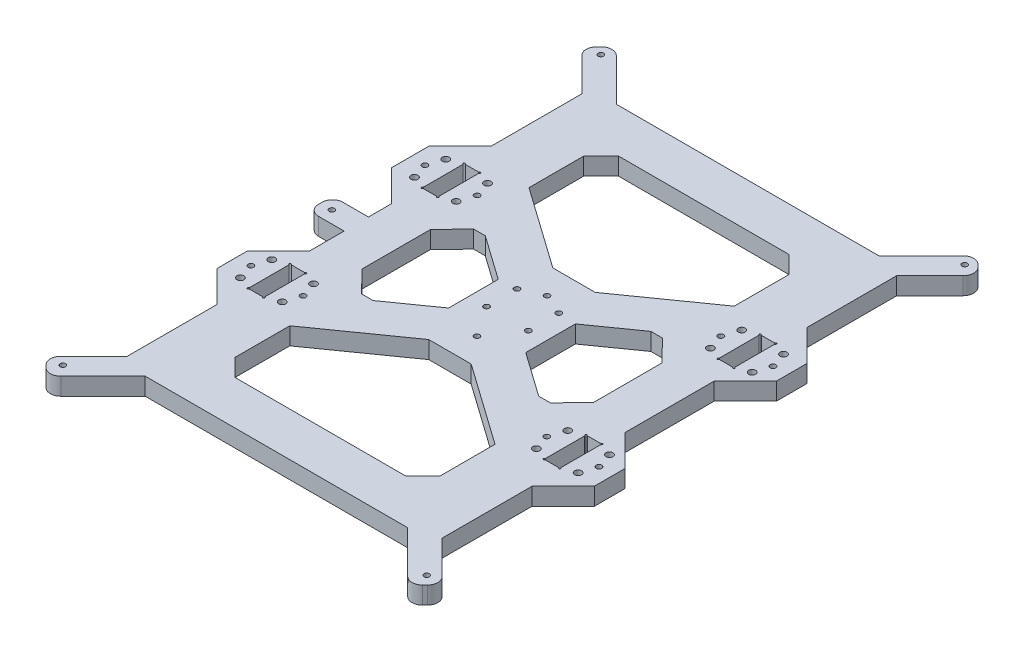
from build123d import *

# Parameters (mm, degrees)
CROQUIS1_R              = 1.6
CROQUIS1_R_2            = 1.55
CROQUIS1_R_3            = 2
SALIENTE_EXTRUIR1_DEPTH = 10


with BuildPart() as part:
    # Croquis1 → Saliente-Extruir1 (new body)
    with BuildSketch(Plane(origin=(0, 0, 0), x_dir=(1, 0, 0), z_dir=(0, 1, 0))):
        with BuildLine():
            Line((-80.748622992, 159.562049364), (-82.162836554, 158.147835801))
            ThreePointArc((-82.162836554, 158.147835801), (-83.920195867, 153.905195114), (-82.162836554, 149.662554427))
            Line((-82.162836554, 149.662554427), (-63.049396634, 130.549114507))
            Line((-63.049396634, 130.549114507), (-63.049396634, 78.874114811))
            Line((-63.049396634, 78.874114811), (-72.931544444, 68.991967001))
            Line((-72.931544444, 68.991967001), (-80.934057958, 60.989453487))
            Line((-80.934057958, 60.989453487), (-80.934057958, 58.991967001))
            Line((-80.934057958, 58.991967001), (-80.934057958, 39.010546513))
            Line((-80.934057958, 39.010546513), (-72.931544444, 31.008032999))
            Line((-72.931544444, 31.008032999), (-63.049396634, 21.125885189))
            Line((-63.049396634, 21.125885189), (-63.049396634, 7.998522997))
            Line((-63.049396634, 7.998522997), (-77.731651282, 7.998522997))
            ThreePointArc((-77.731651282, 7.998522997), (-81.974291969, 6.241163685), (-83.731651282, 1.998522997))
            Line((-83.731651282, 1.998522997), (-83.731651282, -0.001477003))
            ThreePointArc((-83.731651282, -0.001477003), (-81.974291969, -4.24411769), (-77.731651282, -6.001477003))
            Line((-77.731651282, -6.001477003), (-63.049396634, -6.001477003))
            Line((-63.049396634, -6.001477003), (-63.049396634, -25.681678258))
            Line((-63.049396634, -25.681678258), (-72.931544444, -35.563826068))
            Line((-72.931544444, -35.563826068), (-80.934057958, -43.566339582))
            Line((-80.934057958, -43.566339582), (-80.934057958, -60.989453487))
            Line((-80.934057958, -60.989453487), (-72.931544444, -68.991967001))
            Line((-72.931544444, -68.991967001), (-63.049396634, -78.874114811))
            Line((-63.049396634, -78.874114811), (-63.049396634, -130.549114507))
            Line((-63.049396634, -130.549114507), (-82.14179751, -149.641515383))
            ThreePointArc((-82.14179751, -149.641515383), (-83.899156822, -153.88415607), (-82.14179751, -158.126796757))
            Line((-82.14179751, -158.126796757), (-80.727583947, -159.541010319))
            ThreePointArc((-80.727583947, -159.541010319), (-76.48494326, -161.298369632), (-72.242302573, -159.541010319))
            Line((-72.242302573, -159.541010319), (-47.994082864, -135.29279061))
            Line((-47.994082864, -135.29279061), (102.792508483, -135.29279061))
            Line((102.792508483, -135.29279061), (127.051296229, -159.551578356))
            ThreePointArc((127.051296229, -159.551578356), (131.293936917, -161.308937669), (135.536577604, -159.551578356))
            Line((135.536577604, -159.551578356), (136.950791166, -158.137364794))
            ThreePointArc((136.950791166, -158.137364794), (138.708150479, -153.894724107), (136.950791166, -149.65208342))
            Line((136.950791166, -149.65208342), (117.847822253, -130.549114507))
            Line((117.847822253, -130.549114507), (117.847822253, -78.874114811))
            Line((117.847822253, -78.874114811), (127.729970063, -68.991967001))
            Line((127.729970063, -68.991967001), (135.734403375, -60.987533689))
            Line((135.734403375, -60.987533689), (135.734403375, -43.56825938))
            Line((135.734403375, -43.56825938), (127.729970063, -35.563826068))
            Line((127.729970063, -35.563826068), (117.847822253, -25.681678258))
            Line((117.847822253, -25.681678258), (117.847822253, 25.681678258))
            Line((117.847822253, 25.681678258), (127.729970063, 35.563826068))
            Line((127.729970063, 35.563826068), (135.734403375, 43.56825938))
            Line((135.734403375, 43.56825938), (135.734403375, 58.991967001))
            Line((135.734403375, 58.991967001), (135.734403375, 60.987533689))
            Line((135.734403375, 60.987533689), (127.729970063, 68.991967001))
            Line((127.729970063, 68.991967001), (117.847822253, 78.874114811))
            Line((117.847822253, 78.874114811), (117.847822253, 130.549114507))
            Line((117.847822253, 130.549114507), (136.942441846, 149.643734099))
            ThreePointArc((136.942441846, 149.643734099), (138.699801158, 153.886374787), (136.942441846, 158.129015474))
            Line((136.942441846, 158.129015474), (135.528228283, 159.543229036))
            ThreePointArc((135.528228283, 159.543229036), (131.285587596, 161.300588349), (127.042946909, 159.543229036))
            Line((127.042946909, 159.543229036), (102.792508483, 135.29279061))
            Line((102.792508483, 135.29279061), (-47.994082864, 135.29279061))
            Line((-47.994082864, 135.29279061), (-72.263341617, 159.562049364))
            ThreePointArc((-72.263341617, 159.562049364), (-76.505982304, 161.319408677), (-80.748622992, 159.562049364))
        make_face()
        with Locations(Location((-72.60085541, -50.001190143, 0), (0, 0, 270))):
            Circle(CROQUIS1_R, mode=Mode.SUBTRACT)
        with Locations(Location((-72.60085541, 49.957044921, 0), (0, 0, 270))):
            Circle(CROQUIS1_R, mode=Mode.SUBTRACT)
        with Locations(Location((97.39914459, -50.001195503, 0), (0, 0, 270))):
            Circle(CROQUIS1_R, mode=Mode.SUBTRACT)
        with Locations(Location((-77.10078719, 155.498522997, 0), (0, 0, 270))):
            Circle(CROQUIS1_R_2, mode=Mode.SUBTRACT)
        with Locations(Location((131.89921281, 155.498522997, 0), (0, 0, 90))):
            Circle(CROQUIS1_R_2, mode=Mode.SUBTRACT)
        with Locations(Location((97.39914459, 49.957044921, 0), (0, 0, 270))):
            Circle(CROQUIS1_R, mode=Mode.SUBTRACT)
        with Locations(Location((27.39921281, 20.131279802, 0), (0, 0, 270))):
            Circle(CROQUIS1_R_2, mode=Mode.SUBTRACT)
        with Locations(Location((27.39921281, -20.131279802, 0), (0, 0, 90))):
            Circle(CROQUIS1_R_2, mode=Mode.SUBTRACT)
        with Locations(Location((-77.10078719, 0.998522997, 0), (0, 0, 270))):
            Circle(CROQUIS1_R_2, mode=Mode.SUBTRACT)
        with Locations(Location((131.89921281, -153.501477003, 0), (0, 0, 270))):
            Circle(CROQUIS1_R_2, mode=Mode.SUBTRACT)
        with Locations(Location((-77.10078719, -153.501477003, 0), (0, 0, 90))):
            Circle(CROQUIS1_R_2, mode=Mode.SUBTRACT)
        with Locations(Location((100.399202808, 58.95703559, 0), (0, 0, 270))):
            Circle(CROQUIS1_R_3, mode=Mode.SUBTRACT)
        with Locations(Location((124.399202808, 58.95703559, 0), (0, 0, 270))):
            Circle(CROQUIS1_R_3, mode=Mode.SUBTRACT)
        with Locations(Location((124.399202808, 40.95703559, 0), (0, 0, 270))):
            Circle(CROQUIS1_R_3, mode=Mode.SUBTRACT)
        with Locations(Location((100.399202808, 40.95703559, 0), (0, 0, 270))):
            Circle(CROQUIS1_R_3, mode=Mode.SUBTRACT)
        with Locations(Location((100.399202808, -41.001204721, 0), (0, 0, 270))):
            Circle(CROQUIS1_R_3, mode=Mode.SUBTRACT)
        with Locations(Location((124.399202808, -41.001204721, 0), (0, 0, 270))):
            Circle(CROQUIS1_R_3, mode=Mode.SUBTRACT)
        with Locations(Location((124.399202808, -59.001204721, 0), (0, 0, 270))):
            Circle(CROQUIS1_R_3, mode=Mode.SUBTRACT)
        with Locations(Location((100.399202808, -59.001204721, 0), (0, 0, 270))):
            Circle(CROQUIS1_R_3, mode=Mode.SUBTRACT)
        with Locations(Location((-69.60078719, 58.957035704, 0), (0, 0, 270))):
            Circle(CROQUIS1_R_3, mode=Mode.SUBTRACT)
        with Locations(Location((-45.60078719, 58.957035704, 0), (0, 0, 270))):
            Circle(CROQUIS1_R_3, mode=Mode.SUBTRACT)
        with Locations(Location((-45.60078719, 40.957035704, 0), (0, 0, 270))):
            Circle(CROQUIS1_R_3, mode=Mode.SUBTRACT)
        with Locations(Location((-69.60078719, 40.957035704, 0), (0, 0, 270))):
            Circle(CROQUIS1_R_3, mode=Mode.SUBTRACT)
        with Locations(Location((-69.600797192, -41.001199264, 0), (0, 0, 270))):
            Circle(CROQUIS1_R_3, mode=Mode.SUBTRACT)
        with Locations(Location((-45.600797192, -41.001199264, 0), (0, 0, 270))):
            Circle(CROQUIS1_R_3, mode=Mode.SUBTRACT)
        with Locations(Location((-45.600797192, -59.001199264, 0), (0, 0, 270))):
            Circle(CROQUIS1_R_3, mode=Mode.SUBTRACT)
        with Locations(Location((-69.600797192, -59.001199264, 0), (0, 0, 270))):
            Circle(CROQUIS1_R_3, mode=Mode.SUBTRACT)
        with Locations(Location((39.39921281, 14.868720198, 0), (0, 0, 270))):
            Circle(CROQUIS1_R, mode=Mode.SUBTRACT)
        with Locations(Location((15.39921281, 14.868720198, 0), (0, 0, 270))):
            Circle(CROQUIS1_R, mode=Mode.SUBTRACT)
        with Locations(Location((39.39921281, -2.631279802, 0), (0, 0, 270))):
            Circle(CROQUIS1_R, mode=Mode.SUBTRACT)
        with Locations(Location((15.39921281, -2.631279802, 0), (0, 0, 270))):
            Circle(CROQUIS1_R, mode=Mode.SUBTRACT)
        with Locations(Location((-42.60085541, 49.957020155, 0), (0, 0, 270))):
            Circle(CROQUIS1_R, mode=Mode.SUBTRACT)
        with Locations(Location((-42.60085541, -50.001214909, 0), (0, 0, 270))):
            Circle(CROQUIS1_R, mode=Mode.SUBTRACT)
        with Locations(Location((127.39914459, 49.957020155, 0), (0, 0, 270))):
            Circle(CROQUIS1_R, mode=Mode.SUBTRACT)
        with Locations(Location((127.39914459, -50.001220269, 0), (0, 0, 270))):
            Circle(CROQUIS1_R, mode=Mode.SUBTRACT)
        Polygon((-39.036453098, 19.62934529), (-39.036453098, -19.62934529), (-26.843918916, -32.22180516), (-20.164597864, -32.22180516), (5.244035613, -14.252996646), (5.244035613, 14.252996646), (-20.164597864, 32.22180516), (-26.843918916, 32.22180516), align=None, mode=Mode.SUBTRACT)
        Polygon((-31.542972252, 100.139969228), (-31.542972252, 68.700211283), (15.217390497, 35.631608635), (39.581035122, 35.631608635), (86.341397871, 68.700211283), (86.341397871, 100.139969228), (76.341397871, 110.139969228), (-21.542972252, 110.139969228), align=None, mode=Mode.SUBTRACT)
        with BuildLine():
            Line((-61.23476769, -37.951196668), (-53.96680669, -37.951199668))
            ThreePointArc((-53.96680669, -37.951199668), (-53.716807383, -37.884213008), (-53.533794646, -37.701201522))
            ThreePointArc((-53.533794646, -37.701201522), (-52.747229229, -37.597651368), (-52.850783941, -38.384216185))
            ThreePointArc((-52.850783941, -38.384216185), (-53.033795864, -38.567227373), (-53.100784037, -38.81722546))
            Line((-53.100784037, -38.81722546), (-53.100802502, -61.18517446))
            ThreePointArc((-53.100802502, -61.18517446), (-53.033815411, -61.435174515), (-52.85080286, -61.618187368))
            ThreePointArc((-52.85080286, -61.618187368), (-52.747249037, -62.404753791), (-53.533815709, -62.301201857))
            ThreePointArc((-53.533815709, -62.301201857), (-53.71682792, -62.118190482), (-53.966826693, -62.051203569))
            Line((-53.966826693, -62.051203569), (-61.234787693, -62.051197537))
            ThreePointArc((-61.234787693, -62.051197537), (-61.484787748, -62.118184628), (-61.667800601, -62.301197179))
            ThreePointArc((-61.667800601, -62.301197179), (-62.454367024, -62.404751002), (-62.35081509, -61.61818433))
            ThreePointArc((-62.35081509, -61.61818433), (-62.167803248, -61.435171927), (-62.100816152, -61.185172721))
            Line((-62.100816152, -61.185172721), (-62.100797686, -38.817219721))
            ThreePointArc((-62.100797686, -38.817219721), (-62.167784346, -38.567220414), (-62.350795832, -38.384207677))
            ThreePointArc((-62.350795832, -38.384207677), (-62.454345986, -37.59764226), (-61.667781169, -37.701196972))
            ThreePointArc((-61.667781169, -37.701196972), (-61.484768059, -37.884209661), (-61.23476769, -37.951196668))
        make_face(mode=Mode.SUBTRACT)
        with BuildLine():
            Line((108.76523231, -37.951202028), (116.03319331, -37.951205028))
            ThreePointArc((116.03319331, -37.951205028), (116.283192617, -37.884218369), (116.466205354, -37.701206882))
            ThreePointArc((116.466205354, -37.701206882), (117.252770771, -37.597656728), (117.149216059, -38.384221545))
            ThreePointArc((117.149216059, -38.384221545), (116.966204136, -38.567232733), (116.899215963, -38.81723082))
            Line((116.899215963, -38.81723082), (116.899197498, -61.18517982))
            ThreePointArc((116.899197498, -61.18517982), (116.966184589, -61.435179876), (117.14919714, -61.618192729))
            ThreePointArc((117.14919714, -61.618192729), (117.252750963, -62.404759152), (116.466184291, -62.301207218))
            ThreePointArc((116.466184291, -62.301207218), (116.28317208, -62.118195842), (116.033173307, -62.051208929))
            Line((116.033173307, -62.051208929), (108.765212307, -62.051202897))
            ThreePointArc((108.765212307, -62.051202897), (108.515212252, -62.118189989), (108.332199399, -62.301202539))
            ThreePointArc((108.332199399, -62.301202539), (107.545632976, -62.404756362), (107.64918491, -61.61818969))
            ThreePointArc((107.64918491, -61.61818969), (107.832196752, -61.435177287), (107.899183848, -61.185178081))
            Line((107.899183848, -61.185178081), (107.899202314, -38.817225081))
            ThreePointArc((107.899202314, -38.817225081), (107.832215654, -38.567225774), (107.649204168, -38.384213037))
            ThreePointArc((107.649204168, -38.384213037), (107.545654014, -37.59764762), (108.332218831, -37.701202332))
            ThreePointArc((108.332218831, -37.701202332), (108.515231941, -37.884215022), (108.76523231, -37.951202028))
        make_face(mode=Mode.SUBTRACT)
        Polygon((74.963023483, 32.22180516), (49.554390006, 14.252996646), (49.554390006, -14.252996646), (74.963023483, -32.22180516), (81.642344535, -32.22180516), (93.834878717, -19.62934529), (93.834878717, 19.62934529), (81.642344535, 32.22180516), align=None, mode=Mode.SUBTRACT)
        with BuildLine():
            Line((108.76523231, 62.007038396), (116.03319331, 62.007035396))
            ThreePointArc((116.03319331, 62.007035396), (116.283192617, 62.074022056), (116.466205354, 62.257033542))
            ThreePointArc((116.466205354, 62.257033542), (117.252770771, 62.360583696), (117.149216059, 61.574018879))
            ThreePointArc((117.149216059, 61.574018879), (116.966204136, 61.391007691), (116.899215963, 61.141009604))
            Line((116.899215963, 61.141009604), (116.899197498, 38.773060604))
            ThreePointArc((116.899197498, 38.773060604), (116.966184589, 38.523060549), (117.14919714, 38.340047696))
            ThreePointArc((117.14919714, 38.340047696), (117.252750963, 37.553481273), (116.466184291, 37.657033207))
            ThreePointArc((116.466184291, 37.657033207), (116.28317208, 37.840044582), (116.033173307, 37.907031495))
            Line((116.033173307, 37.907031495), (108.765212307, 37.907037528))
            ThreePointArc((108.765212307, 37.907037528), (108.515212252, 37.840050436), (108.332199399, 37.657037885))
            ThreePointArc((108.332199399, 37.657037885), (107.545632976, 37.553484062), (107.64918491, 38.340050734))
            ThreePointArc((107.64918491, 38.340050734), (107.832196752, 38.523063137), (107.899183848, 38.773062343))
            Line((107.899183848, 38.773062343), (107.899202314, 61.141015343))
            ThreePointArc((107.899202314, 61.141015343), (107.832215654, 61.39101465), (107.649204168, 61.574027387))
            ThreePointArc((107.649204168, 61.574027387), (107.545654014, 62.360592804), (108.332218831, 62.257038092))
            ThreePointArc((108.332218831, 62.257038092), (108.515231941, 62.074025403), (108.76523231, 62.007038396))
        make_face(mode=Mode.SUBTRACT)
        Polygon((-21.542972252, -110.139969228), (76.341397871, -110.139969228), (86.341397871, -100.139969228), (86.341397871, -68.700211283), (39.581035122, -35.631608635), (15.217390497, -35.631608635), (-31.542972252, -68.700211283), (-31.542972252, -100.139969228), align=None, mode=Mode.SUBTRACT)
        with BuildLine():
            Line((-61.23476769, 62.007038396), (-53.96680669, 62.007035396))
            ThreePointArc((-53.96680669, 62.007035396), (-53.716807383, 62.074022056), (-53.533794646, 62.257033542))
            ThreePointArc((-53.533794646, 62.257033542), (-52.747229229, 62.360583696), (-52.850783941, 61.574018879))
            ThreePointArc((-52.850783941, 61.574018879), (-53.033795864, 61.391007691), (-53.100784037, 61.141009604))
            Line((-53.100784037, 61.141009604), (-53.100802502, 38.773060604))
            ThreePointArc((-53.100802502, 38.773060604), (-53.033815411, 38.523060549), (-52.85080286, 38.340047696))
            ThreePointArc((-52.85080286, 38.340047696), (-52.747249037, 37.553481273), (-53.533815709, 37.657033207))
            ThreePointArc((-53.533815709, 37.657033207), (-53.71682792, 37.840044582), (-53.966826693, 37.907031495))
            Line((-53.966826693, 37.907031495), (-61.234787693, 37.907037528))
            ThreePointArc((-61.234787693, 37.907037528), (-61.484787748, 37.840050436), (-61.667800601, 37.657037885))
            ThreePointArc((-61.667800601, 37.657037885), (-62.454367024, 37.553484062), (-62.35081509, 38.340050734))
            ThreePointArc((-62.35081509, 38.340050734), (-62.167803248, 38.523063137), (-62.100816152, 38.773062343))
            Line((-62.100816152, 38.773062343), (-62.100797686, 61.141015343))
            ThreePointArc((-62.100797686, 61.141015343), (-62.167784346, 61.39101465), (-62.350795832, 61.574027387))
            ThreePointArc((-62.350795832, 61.574027387), (-62.454345986, 62.360592804), (-61.667781169, 62.257038092))
            ThreePointArc((-61.667781169, 62.257038092), (-61.484768059, 62.074025403), (-61.23476769, 62.007038396))
        make_face(mode=Mode.SUBTRACT)
    extrude(amount=SALIENTE_EXTRUIR1_DEPTH)


solid = part.part
